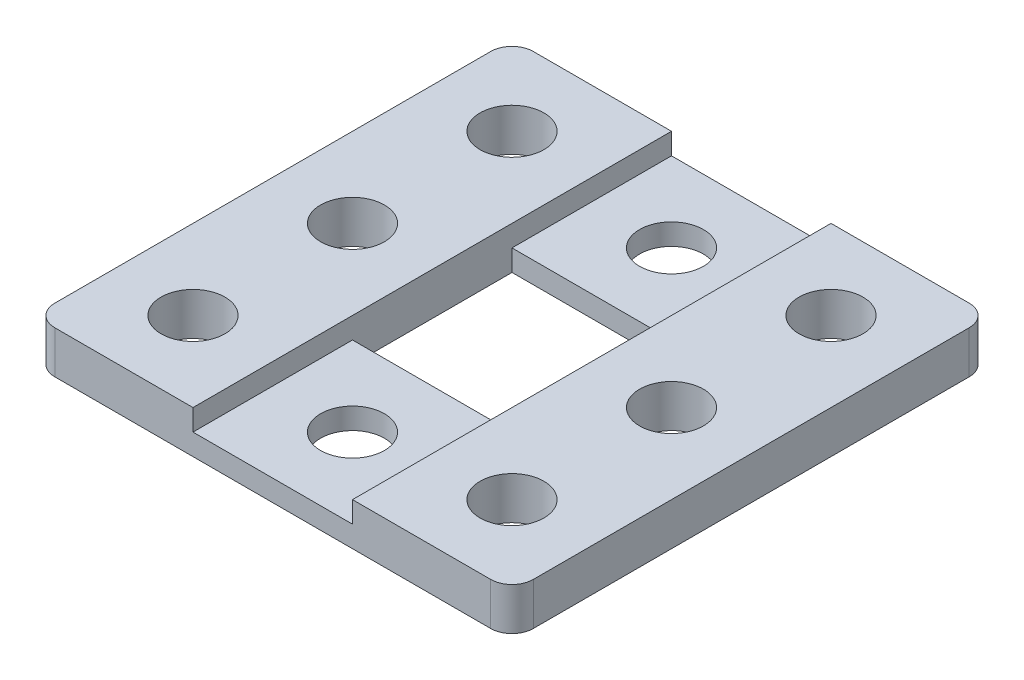
from build123d import *

# Parameters (mm, degrees)
SKETCH1_W           = 22.5
SKETCH1_H           = 22.5
BOSS_EXTRUDE1_DEPTH = 2
SKETCH2_W           = 7.5
SKETCH2_H           = 22.5
CUT_EXTRUDE1_DEPTH  = 1
SKETCH4_R           = 1.5
CUT_EXTRUDE2_DEPTH  = 2
SKETCH5_W           = 7.5
SKETCH5_H           = 7.5
CUT_EXTRUDE3_DEPTH  = 2
SKETCH6_R           = 1.5
CUT_EXTRUDE4_DEPTH  = 2
SKETCH7_R           = 1.5
CUT_EXTRUDE5_DEPTH  = 2
FILLET1_R           = 1


with BuildPart() as part:
    # Sketch1 → Boss-Extrude1 (new body)
    with BuildSketch(Plane(origin=(0, 0, 0), x_dir=(1, 0, 0), z_dir=(0, 1, 0))):
        Rectangle(SKETCH1_W, SKETCH1_H)
    extrude(amount=BOSS_EXTRUDE1_DEPTH)

    # Sketch2 → Cut-Extrude1 (cut)
    with BuildSketch(Plane(origin=(0, 2, 0), x_dir=(1, 0, 0), z_dir=(0, 1, 0))):
        Rectangle(SKETCH2_W, SKETCH2_H)
    extrude(amount=-CUT_EXTRUDE1_DEPTH, mode=Mode.SUBTRACT)

    # Sketch4 → Cut-Extrude2 (cut)
    with BuildSketch(Plane(origin=(0, 1, 0), x_dir=(1, 0, 0), z_dir=(0, 1, 0))):
        with Locations(Location((0, 7.5, 0), (0, 0, 270))):
            Circle(SKETCH4_R)
        with Locations(Location((0, -7.5, 0), (0, 0, 270))):
            Circle(SKETCH4_R)
    extrude(amount=-CUT_EXTRUDE2_DEPTH, mode=Mode.SUBTRACT)

    # Sketch5 → Cut-Extrude3 (cut)
    with BuildSketch(Plane(origin=(0, 1, 0), x_dir=(1, 0, 0), z_dir=(0, 1, 0))):
        Rectangle(SKETCH5_W, SKETCH5_H)
    extrude(amount=-CUT_EXTRUDE3_DEPTH, mode=Mode.SUBTRACT)

    # Sketch6 → Cut-Extrude4 (cut)
    with BuildSketch(Plane(origin=(0, 2, 0), x_dir=(1, 0, 0), z_dir=(0, 1, 0))):
        with Locations(Location((-7.5, 7.5, 0), (0, 0, 270))):
            Circle(SKETCH6_R)
        with Locations(Location((-7.5, -7.5, 0), (0, 0, 270))):
            Circle(SKETCH6_R)
        with Locations(Location((-7.5, 0, 0), (0, 0, 270))):
            Circle(SKETCH6_R)
    extrude(amount=-CUT_EXTRUDE4_DEPTH, mode=Mode.SUBTRACT)

    # Sketch7 → Cut-Extrude5 (cut)
    with BuildSketch(Plane(origin=(0, 2, 0), x_dir=(1, 0, 0), z_dir=(0, 1, 0))):
        with Locations(Location((7.5, 0, 0), (0, 0, 270))):
            Circle(SKETCH7_R)
        with Locations(Location((7.5, 7.5, 0), (0, 0, 270))):
            Circle(SKETCH7_R)
        with Locations(Location((7.5, -7.5, 0), (0, 0, 270))):
            Circle(SKETCH7_R)
    extrude(amount=-CUT_EXTRUDE5_DEPTH, mode=Mode.SUBTRACT)

    # Fillet1
    fillet1_edges = [part.edges().sort_by_distance(p)[0] for p in [
        (11.25, 1, 11.25),
        (-11.25, 1, 11.25),
        (-11.25, 1, -11.25),
        (11.25, 1, -11.25),
    ]]
    fillet(fillet1_edges, radius=FILLET1_R)


solid = part.part
